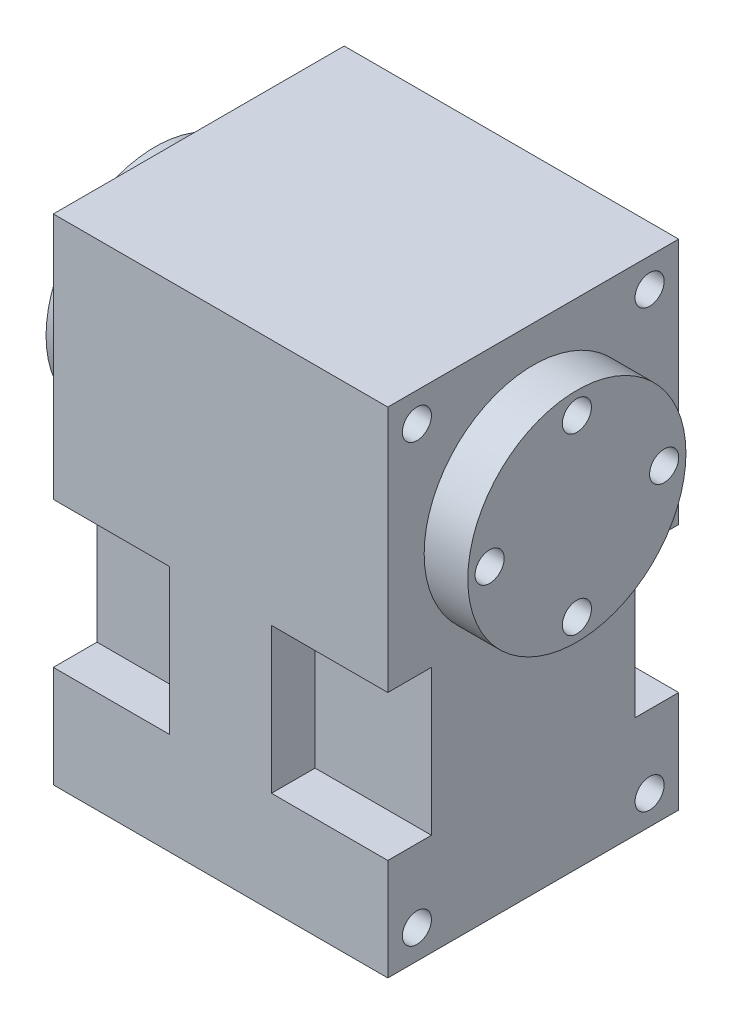
from build123d import *

# Parameters (mm, degrees)
SKETCH1_W           = 23
SKETCH1_H           = 20
BOSS_EXTRUDE1_DEPTH = 17
SKETCH2_R           = 7.5
SKETCH2_R_2         = 1
BOSS_EXTRUDE2_DEPTH = 3
SKETCH3_W           = 3
SKETCH3_H           = 10
CUT_EXTRUDE1_DEPTH  = 8
SKETCH4_R           = 1
CUT_EXTRUDE2_DEPTH  = 33.634337744


with BuildPart() as part:
    # Sketch1 → Boss-Extrude1 (new, symmetric)
    with BuildSketch(Plane(origin=(0, 0, 0), x_dir=(1, 0, 0), z_dir=(0, 1, 0))):
        Rectangle(SKETCH1_W, SKETCH1_H)
    extrude(amount=BOSS_EXTRUDE1_DEPTH, both=True)

    # Sketch2 → Boss-Extrude2 (add)
    with BuildSketch(Plane(origin=(11.5, 0, 0), x_dir=(0, 0, -1), z_dir=(1, 0, 0))):
        with Locations((0, 7)):
            Circle(SKETCH2_R)
        with Locations((0, 13)):
            Circle(SKETCH2_R_2, mode=Mode.SUBTRACT)
        with Locations((6, 7)):
            Circle(SKETCH2_R_2, mode=Mode.SUBTRACT)
        with Locations((0, 1)):
            Circle(SKETCH2_R_2, mode=Mode.SUBTRACT)
        with Locations((-6, 7)):
            Circle(SKETCH2_R_2, mode=Mode.SUBTRACT)
    boss_extrude2 = extrude(amount=BOSS_EXTRUDE2_DEPTH)

    # Mirror1: Boss-Extrude2 across plane
    add(boss_extrude2.mirror(Plane(origin=(0, 0, 0), x_dir=(0, 0, 1), z_dir=(1, 0, 0))))

    # Sketch3 → Cut-Extrude1 (cut)
    with BuildSketch(Plane(origin=(11.5, 0, 0), x_dir=(0, 0, -1), z_dir=(1, 0, 0))):
        with Locations((-8.5, -5)):
            Rectangle(SKETCH3_W, SKETCH3_H)
        with Locations((8.5, -5)):
            Rectangle(SKETCH3_W, SKETCH3_H)
    cut_extrude1 = extrude(amount=-CUT_EXTRUDE1_DEPTH, mode=Mode.SUBTRACT)

    # Mirror2: Cut-Extrude1 across plane
    add(cut_extrude1.mirror(Plane(origin=(0, 0, 0), x_dir=(0, 0, 1), z_dir=(1, 0, 0))), mode=Mode.SUBTRACT)

    # Sketch4 → Cut-Extrude2 (cut, through all)
    with BuildSketch(Plane(origin=(11.5, 0, 0), x_dir=(0, 0, -1), z_dir=(1, 0, 0))):
        with Locations((-8, 15)):
            Circle(SKETCH4_R)
        with Locations((8, 15)):
            Circle(SKETCH4_R)
        with Locations((-8, -15)):
            Circle(SKETCH4_R)
        with Locations((8, -15)):
            Circle(SKETCH4_R)
    extrude(amount=-CUT_EXTRUDE2_DEPTH, mode=Mode.SUBTRACT)


solid = part.part
